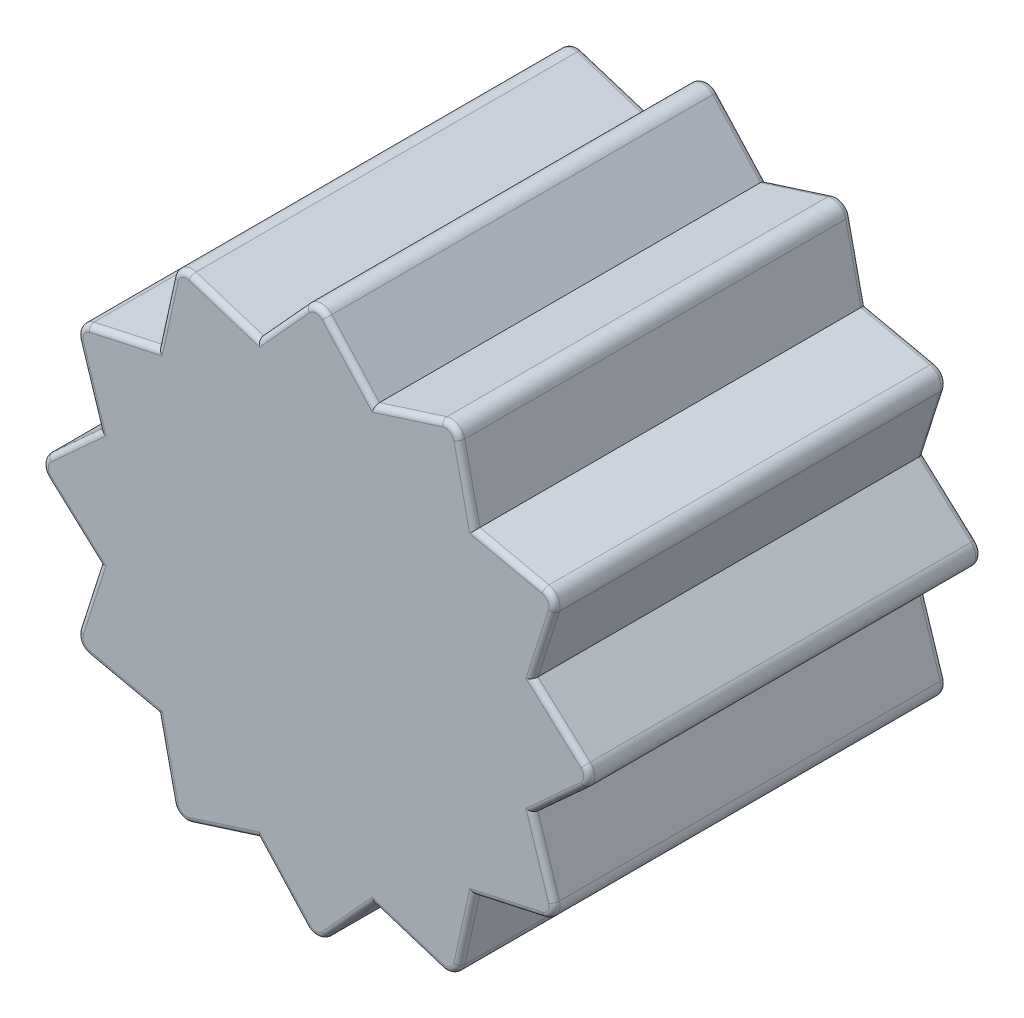
from build123d import *

# Parameters (mm, degrees)
BOSS_EXTRUDE1_DEPTH = 14
CUT_EXTRUDE1_DEPTH  = 11
FILLET1_R           = 0.2
SKETCH4_R           = 3.5
CUT_EXTRUDE2_DEPTH  = 0.6
FILLET42_R          = 0.1


with BuildPart() as part:
    # Sketch1 → Boss-Extrude1 (new body)
    with BuildSketch(Plane.XY):
        with BuildLine():
            Line((0.369600818, 9.594334153), (2.070552361, 7.72740661))
            Line((2.070552361, 7.72740661), (4.477083379, 8.493737518))
            ThreePointArc((4.477083379, 8.493737518), (4.878796032, 8.450322607), (5.117250775, 8.1241367))
            Line((5.117250775, 8.1241367), (5.656854249, 5.656854249))
            Line((5.656854249, 5.656854249), (8.1241367, 5.117250775))
            ThreePointArc((8.1241367, 5.117250775), (8.450322607, 4.878796032), (8.493737518, 4.477083379))
            Line((8.493737518, 4.477083379), (7.72740661, 2.070552361))
            Line((7.72740661, 2.070552361), (9.594334153, 0.369600818))
            ThreePointArc((9.594334153, 0.369600818), (9.757592063, 0), (9.594334153, -0.369600818))
            Line((9.594334153, -0.369600818), (7.72740661, -2.070552361))
            Line((7.72740661, -2.070552361), (8.493737518, -4.477083379))
            ThreePointArc((8.493737518, -4.477083379), (8.450322607, -4.878796032), (8.1241367, -5.117250775))
            Line((8.1241367, -5.117250775), (5.656854249, -5.656854249))
            Line((5.656854249, -5.656854249), (5.117250775, -8.1241367))
            ThreePointArc((5.117250775, -8.1241367), (4.878796032, -8.450322607), (4.477083379, -8.493737518))
            Line((4.477083379, -8.493737518), (2.070552361, -7.72740661))
            Line((2.070552361, -7.72740661), (0.369600818, -9.594334153))
            ThreePointArc((0.369600818, -9.594334153), (0, -9.757592063), (-0.369600818, -9.594334153))
            Line((-0.369600818, -9.594334153), (-2.070552361, -7.72740661))
            Line((-2.070552361, -7.72740661), (-4.477083379, -8.493737518))
            ThreePointArc((-4.477083379, -8.493737518), (-4.878796032, -8.450322607), (-5.117250775, -8.1241367))
            Line((-5.117250775, -8.1241367), (-5.656854249, -5.656854249))
            Line((-5.656854249, -5.656854249), (-8.1241367, -5.117250775))
            ThreePointArc((-8.1241367, -5.117250775), (-8.450322607, -4.878796032), (-8.493737518, -4.477083379))
            Line((-8.493737518, -4.477083379), (-7.72740661, -2.070552361))
            Line((-7.72740661, -2.070552361), (-9.594334153, -0.369600818))
            ThreePointArc((-9.594334153, -0.369600818), (-9.757592063, 0), (-9.594334153, 0.369600818))
            Line((-9.594334153, 0.369600818), (-7.72740661, 2.070552361))
            Line((-7.72740661, 2.070552361), (-8.493737518, 4.477083379))
            ThreePointArc((-8.493737518, 4.477083379), (-8.450322607, 4.878796032), (-8.1241367, 5.117250775))
            Line((-8.1241367, 5.117250775), (-5.656854249, 5.656854249))
            Line((-5.656854249, 5.656854249), (-5.117250775, 8.1241367))
            ThreePointArc((-5.117250775, 8.1241367), (-4.878796032, 8.450322607), (-4.477083379, 8.493737518))
            Line((-4.477083379, 8.493737518), (-2.070552361, 7.72740661))
            Line((-2.070552361, 7.72740661), (-0.369600818, 9.594334153))
            ThreePointArc((-0.369600818, 9.594334153), (0, 9.757592063), (0.369600818, 9.594334153))
        make_face()
    extrude(amount=BOSS_EXTRUDE1_DEPTH)

    # Sketch2 → Cut-Extrude1 (cut)
    with BuildSketch(Plane(origin=(0, 0, 0), x_dir=(-1, 0, 0), z_dir=(0, 0, -1))):
        with BuildLine():
            ThreePointArc((-1.941278917, 1.947802907), (-2.106622219, 1.767665927), (-2.255310951, 1.573554103))
            ThreePointArc((-2.255310951, 1.573554103), (-2.663028117, 1.5375), (-2.490393303, 1.166379525))
            ThreePointArc((-2.490393303, 1.166379525), (-2.584154707, 0.940555394), (-2.657486258, 0.707295405))
            ThreePointArc((-2.657486258, 0.707295405), (-3.028283841, 0.533968146), (-2.739129502, 0.244273558))
            ThreePointArc((-2.739129502, 0.244273558), (-2.75, 0), (-2.739129502, -0.244273558))
            ThreePointArc((-2.739129502, -0.244273558), (-3.028283841, -0.533968146), (-2.657486258, -0.707295405))
            ThreePointArc((-2.657486258, -0.707295405), (-2.584154707, -0.940555394), (-2.490393303, -1.166379525))
            ThreePointArc((-2.490393303, -1.166379525), (-2.663028117, -1.5375), (-2.255310951, -1.573554103))
            ThreePointArc((-2.255310951, -1.573554103), (-2.106622219, -1.767665927), (-1.941278917, -1.947802907))
            ThreePointArc((-1.941278917, -1.947802907), (-1.9765719, -2.355586663), (-1.581111858, -2.250018954))
            ThreePointArc((-1.581111858, -2.250018954), (-1.375, -2.38156986), (-1.158017644, -2.494292512))
            ThreePointArc((-1.158017644, -2.494292512), (-1.051711941, -2.889554809), (-0.71620734, -2.655098312))
            ThreePointArc((-0.71620734, -2.655098312), (-0.477532489, -2.708221321), (-0.235082352, -2.739933628))
            ThreePointArc((-0.235082352, -2.739933628), (0, -3.075), (0.235082352, -2.739933628))
            ThreePointArc((0.235082352, -2.739933628), (0.477532489, -2.708221321), (0.71620734, -2.655098312))
            ThreePointArc((0.71620734, -2.655098312), (1.051711941, -2.889554809), (1.158017644, -2.494292512))
            ThreePointArc((1.158017644, -2.494292512), (1.375, -2.38156986), (1.581111858, -2.250018954))
            ThreePointArc((1.581111858, -2.250018954), (1.9765719, -2.355586663), (1.941278917, -1.947802907))
            ThreePointArc((1.941278917, -1.947802907), (2.106622219, -1.767665927), (2.255310951, -1.573554103))
            ThreePointArc((2.255310951, -1.573554103), (2.663028117, -1.5375), (2.490393303, -1.166379525))
            ThreePointArc((2.490393303, -1.166379525), (2.584154707, -0.940555394), (2.657486258, -0.707295405))
            ThreePointArc((2.657486258, -0.707295405), (3.028283841, -0.533968146), (2.739129502, -0.244273558))
            ThreePointArc((2.739129502, -0.244273558), (2.75, 0), (2.739129502, 0.244273558))
            ThreePointArc((2.739129502, 0.244273558), (3.028283841, 0.533968146), (2.657486258, 0.707295405))
            ThreePointArc((2.657486258, 0.707295405), (2.584154707, 0.940555394), (2.490393303, 1.166379525))
            ThreePointArc((2.490393303, 1.166379525), (2.663028117, 1.5375), (2.255310951, 1.573554103))
            ThreePointArc((2.255310951, 1.573554103), (2.106622219, 1.767665927), (1.941278917, 1.947802907))
            ThreePointArc((1.941278917, 1.947802907), (1.9765719, 2.355586663), (1.581111858, 2.250018954))
            ThreePointArc((1.581111858, 2.250018954), (1.375, 2.38156986), (1.158017644, 2.494292512))
            ThreePointArc((1.158017644, 2.494292512), (1.051711941, 2.889554809), (0.71620734, 2.655098312))
            ThreePointArc((0.71620734, 2.655098312), (0.477532489, 2.708221321), (0.235082352, 2.739933628))
            ThreePointArc((0.235082352, 2.739933628), (0, 3.075), (-0.235082352, 2.739933628))
            ThreePointArc((-0.235082352, 2.739933628), (-0.477532489, 2.708221321), (-0.71620734, 2.655098312))
            ThreePointArc((-0.71620734, 2.655098312), (-1.051711941, 2.889554809), (-1.158017644, 2.494292512))
            ThreePointArc((-1.158017644, 2.494292512), (-1.375, 2.38156986), (-1.581111858, 2.250018954))
            ThreePointArc((-1.581111858, 2.250018954), (-1.9765719, 2.355586663), (-1.941278917, 1.947802907))
        make_face()
    extrude(amount=-CUT_EXTRUDE1_DEPTH, mode=Mode.SUBTRACT)

    # Fillet1
    fillet1_edges = [part.edges().sort_by_distance(p)[0] for p in [
        (4.878796032, -8.450322607, 14),
        (5.387052512, -6.890495475, 14),
        (-4.878796032, 8.450322607, 14),
        (6.890495475, -5.387052512, 14),
        (8.450322607, -4.878796032, 14),
        (8.110572064, -3.27381787, 14),
        (8.660870382, -1.22007659, 14),
        (9.757592063, 0, 14),
        (8.660870382, 1.22007659, 14),
        (1.9765719, 2.355586663, 0),
        (2.106622219, 1.767665927, 0),
        (2.663028117, 1.5375, 0),
        (2.584154707, 0.940555394, 0),
        (3.028283841, 0.533968146, 0),
        (2.75, 0, 0),
        (3.028283841, -0.533968146, 0),
        (2.584154707, -0.940555394, 0),
        (2.663028117, -1.5375, 0),
        (2.106622219, -1.767665927, 0),
        (1.9765719, -2.355586663, 0),
        (8.110572064, 3.27381787, 14),
        (1.375, -2.38156986, 0),
        (1.051711941, -2.889554809, 0),
        (0.477532489, -2.708221321, 0),
        (0, -3.075, 0),
        (-0.477532489, -2.708221321, 0),
        (-1.051711941, -2.889554809, 0),
        (-1.375, -2.38156986, 0),
        (-1.9765719, -2.355586663, 0),
        (-2.106622219, -1.767665927, 0),
        (-2.663028117, -1.5375, 0),
        (-2.584154707, -0.940555394, 0),
        (-3.028283841, -0.533968146, 0),
        (-2.75, 0, 0),
        (-3.028283841, 0.533968146, 0),
        (-2.584154707, 0.940555394, 0),
        (-2.663028117, 1.5375, 0),
        (-2.106622219, 1.767665927, 0),
        (8.450322607, 4.878796032, 14),
        (-1.9765719, 2.355586663, 0),
        (-1.375, 2.38156986, 0),
        (-1.051711941, 2.889554809, 0),
        (-0.477532489, 2.708221321, 0),
        (0, 3.075, 0),
        (0.477532489, 2.708221321, 0),
        (1.051711941, 2.889554809, 0),
        (1.375, 2.38156986, 0),
        (6.890495475, 5.387052512, 14),
        (5.387052512, 6.890495475, 14),
        (-5.387052512, 6.890495475, 14),
        (4.878796032, 8.450322607, 14),
        (3.27381787, 8.110572064, 14),
        (1.22007659, 8.660870382, 14),
        (0, 9.757592063, 14),
        (-1.22007659, 8.660870382, 14),
        (-6.890495475, 5.387052512, 14),
        (-8.450322607, 4.878796032, 14),
        (-8.110572064, 3.27381787, 14),
        (-8.660870382, 1.22007659, 14),
        (-1.22007659, 8.660870382, 0),
        (0, 9.757592063, 0),
        (1.22007659, 8.660870382, 0),
        (3.27381787, 8.110572064, 0),
        (4.878796032, 8.450322607, 0),
        (5.387052512, 6.890495475, 0),
        (6.890495475, 5.387052512, 0),
        (-9.757592063, 0, 14),
        (8.450322607, 4.878796032, 0),
        (8.110572064, 3.27381787, 0),
        (8.660870382, 1.22007659, 0),
        (9.757592063, 0, 0),
        (8.660870382, -1.22007659, 0),
        (8.110572064, -3.27381787, 0),
        (8.450322607, -4.878796032, 0),
        (6.890495475, -5.387052512, 0),
        (5.387052512, -6.890495475, 0),
        (4.878796032, -8.450322607, 0),
        (-8.660870382, -1.22007659, 14),
        (3.27381787, -8.110572064, 0),
        (1.22007659, -8.660870382, 0),
        (0, -9.757592063, 0),
        (-1.22007659, -8.660870382, 0),
        (-3.27381787, -8.110572064, 0),
        (-4.878796032, -8.450322607, 0),
        (-5.387052512, -6.890495475, 0),
        (-6.890495475, -5.387052512, 0),
        (-8.450322607, -4.878796032, 0),
        (-8.110572064, -3.27381787, 0),
        (-8.110572064, -3.27381787, 14),
        (-8.660870382, -1.22007659, 0),
        (-9.757592063, 0, 0),
        (-8.660870382, 1.22007659, 0),
        (-8.110572064, 3.27381787, 0),
        (-8.450322607, 4.878796032, 0),
        (-6.890495475, 5.387052512, 0),
        (-5.387052512, 6.890495475, 0),
        (-4.878796032, 8.450322607, 0),
        (-3.27381787, 8.110572064, 0),
        (-8.450322607, -4.878796032, 14),
        (-3.27381787, 8.110572064, 14),
        (-6.890495475, -5.387052512, 14),
        (-5.387052512, -6.890495475, 14),
        (-4.878796032, -8.450322607, 14),
        (-3.27381787, -8.110572064, 14),
        (-1.22007659, -8.660870382, 14),
        (0, -9.757592063, 14),
        (1.22007659, -8.660870382, 14),
        (3.27381787, -8.110572064, 14),
    ]]
    fillet(fillet1_edges, radius=FILLET1_R)

    # Sketch4 → Cut-Extrude2 (cut)
    with BuildSketch(Plane(origin=(0, 0, 0), x_dir=(-1, 0, 0), z_dir=(0, 0, -1))):
        Circle(SKETCH4_R)
    extrude(amount=-CUT_EXTRUDE2_DEPTH, mode=Mode.SUBTRACT)

    # Fillet42
    fillet42_edges = [part.edges().sort_by_distance(p)[0] for p in [
        (1.9765719, 2.355586663, 11),
        (1.941278917, 1.947802907, 5.8),
        (1.375, 2.38156986, 11),
        (1.581111858, 2.250018954, 5.8),
        (1.051711941, 2.889554809, 11),
        (1.158017644, 2.494292512, 5.8),
        (0.477532489, 2.708221321, 11),
        (0.71620734, 2.655098312, 5.8),
        (0, 3.075, 11),
        (0.235082352, 2.739933628, 5.8),
        (-0.477532489, 2.708221321, 11),
        (-0.235082352, 2.739933628, 5.8),
        (-1.051711941, 2.889554809, 11),
        (-0.71620734, 2.655098312, 5.8),
        (-1.375, 2.38156986, 11),
        (-1.158017644, 2.494292512, 5.8),
        (-1.9765719, 2.355586663, 11),
        (-1.581111858, 2.250018954, 5.8),
        (-2.106622219, 1.767665927, 11),
        (-1.941278917, 1.947802907, 5.8),
        (-2.663028117, 1.5375, 11),
        (-2.255310951, 1.573554103, 5.8),
        (-2.584154707, 0.940555394, 11),
        (-2.490393303, 1.166379525, 5.8),
        (-3.028283841, 0.533968146, 11),
        (-2.657486258, 0.707295405, 5.8),
        (-2.75, 0, 11),
        (-2.739129502, 0.244273558, 5.8),
        (-3.028283841, -0.533968146, 11),
        (-2.739129502, -0.244273558, 5.8),
        (-2.584154707, -0.940555394, 11),
        (-2.657486258, -0.707295405, 5.8),
        (-2.663028117, -1.5375, 11),
        (-2.490393303, -1.166379525, 5.8),
        (-2.106622219, -1.767665927, 11),
        (-2.255310951, -1.573554103, 5.8),
        (-1.9765719, -2.355586663, 11),
        (-1.941278917, -1.947802907, 5.8),
        (-1.375, -2.38156986, 11),
        (-1.581111858, -2.250018954, 5.8),
        (-1.051711941, -2.889554809, 11),
        (-1.158017644, -2.494292512, 5.8),
        (-0.477532489, -2.708221321, 11),
        (-0.71620734, -2.655098312, 5.8),
        (0, -3.075, 11),
        (-0.235082352, -2.739933628, 5.8),
        (0.477532489, -2.708221321, 11),
        (0.235082352, -2.739933628, 5.8),
        (1.051711941, -2.889554809, 11),
        (0.71620734, -2.655098312, 5.8),
        (1.375, -2.38156986, 11),
        (1.158017644, -2.494292512, 5.8),
        (1.9765719, -2.355586663, 11),
        (1.581111858, -2.250018954, 5.8),
        (2.106622219, -1.767665927, 11),
        (1.941278917, -1.947802907, 5.8),
        (2.663028117, -1.5375, 11),
        (2.255310951, -1.573554103, 5.8),
        (2.584154707, -0.940555394, 11),
        (2.490393303, -1.166379525, 5.8),
        (3.028283841, -0.533968146, 11),
        (2.657486258, -0.707295405, 5.8),
        (2.75, 0, 11),
        (2.739129502, -0.244273558, 5.8),
        (3.028283841, 0.533968146, 11),
        (2.739129502, 0.244273558, 5.8),
        (2.584154707, 0.940555394, 11),
        (2.657486258, 0.707295405, 5.8),
        (2.663028117, 1.5375, 11),
        (2.490393303, 1.166379525, 5.8),
        (2.106622219, 1.767665927, 11),
        (2.255310951, 1.573554103, 5.8),
        (2.106622219, 1.767665927, 0.6),
        (3.5, 0, 0.6),
        (1.9765719, 2.355586663, 0.6),
        (1.375, 2.38156986, 0.6),
        (1.051711941, 2.889554809, 0.6),
        (0.477532489, 2.708221321, 0.6),
        (0, 3.075, 0.6),
        (-0.477532489, 2.708221321, 0.6),
        (-1.051711941, 2.889554809, 0.6),
        (-1.375, 2.38156986, 0.6),
        (-1.9765719, 2.355586663, 0.6),
        (-2.106622219, 1.767665927, 0.6),
        (-2.663028117, 1.5375, 0.6),
        (-2.584154707, 0.940555394, 0.6),
        (-3.028283841, 0.533968146, 0.6),
        (-2.75, 0, 0.6),
        (-3.028283841, -0.533968146, 0.6),
        (-2.584154707, -0.940555394, 0.6),
        (-2.663028117, -1.5375, 0.6),
        (-2.106622219, -1.767665927, 0.6),
        (-1.9765719, -2.355586663, 0.6),
        (-1.375, -2.38156986, 0.6),
        (-1.051711941, -2.889554809, 0.6),
        (-0.477532489, -2.708221321, 0.6),
        (0, -3.075, 0.6),
        (0.477532489, -2.708221321, 0.6),
        (1.051711941, -2.889554809, 0.6),
        (1.375, -2.38156986, 0.6),
        (1.9765719, -2.355586663, 0.6),
        (2.106622219, -1.767665927, 0.6),
        (2.663028117, -1.5375, 0.6),
        (2.584154707, -0.940555394, 0.6),
        (3.028283841, -0.533968146, 0.6),
        (2.75, 0, 0.6),
        (3.028283841, 0.533968146, 0.6),
        (2.584154707, 0.940555394, 0.6),
        (2.663028117, 1.5375, 0.6),
    ]]
    fillet(fillet42_edges, radius=FILLET42_R)


solid = part.part
